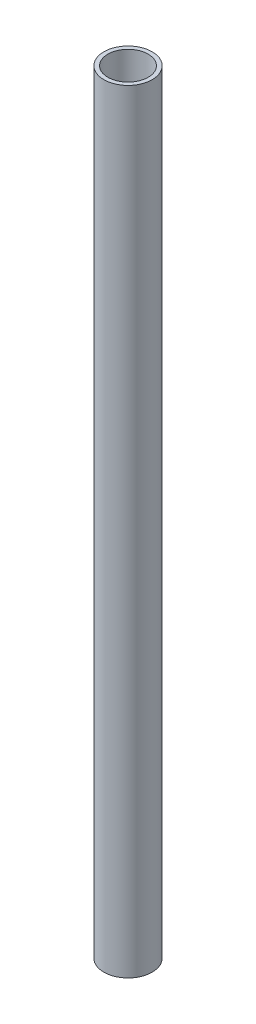
from build123d import *

# Parameters (mm, degrees)
SKETCH1_R           = 9.525
SKETCH1_R_2         = 7.9375
BOSS_EXTRUDE1_DEPTH = 304.8


with BuildPart() as part:
    # Sketch1 → Boss-Extrude1 (new body)
    with BuildSketch(Plane(origin=(0, 0, 0), x_dir=(1, 0, 0), z_dir=(0, 1, 0))):
        with Locations(Location((0, 0, 0), (0, 0, 90))):
            Circle(SKETCH1_R)
        with Locations(Location((0, 0, 0), (0, 0, 90))):
            Circle(SKETCH1_R_2, mode=Mode.SUBTRACT)
    extrude(amount=BOSS_EXTRUDE1_DEPTH)


solid = part.part
